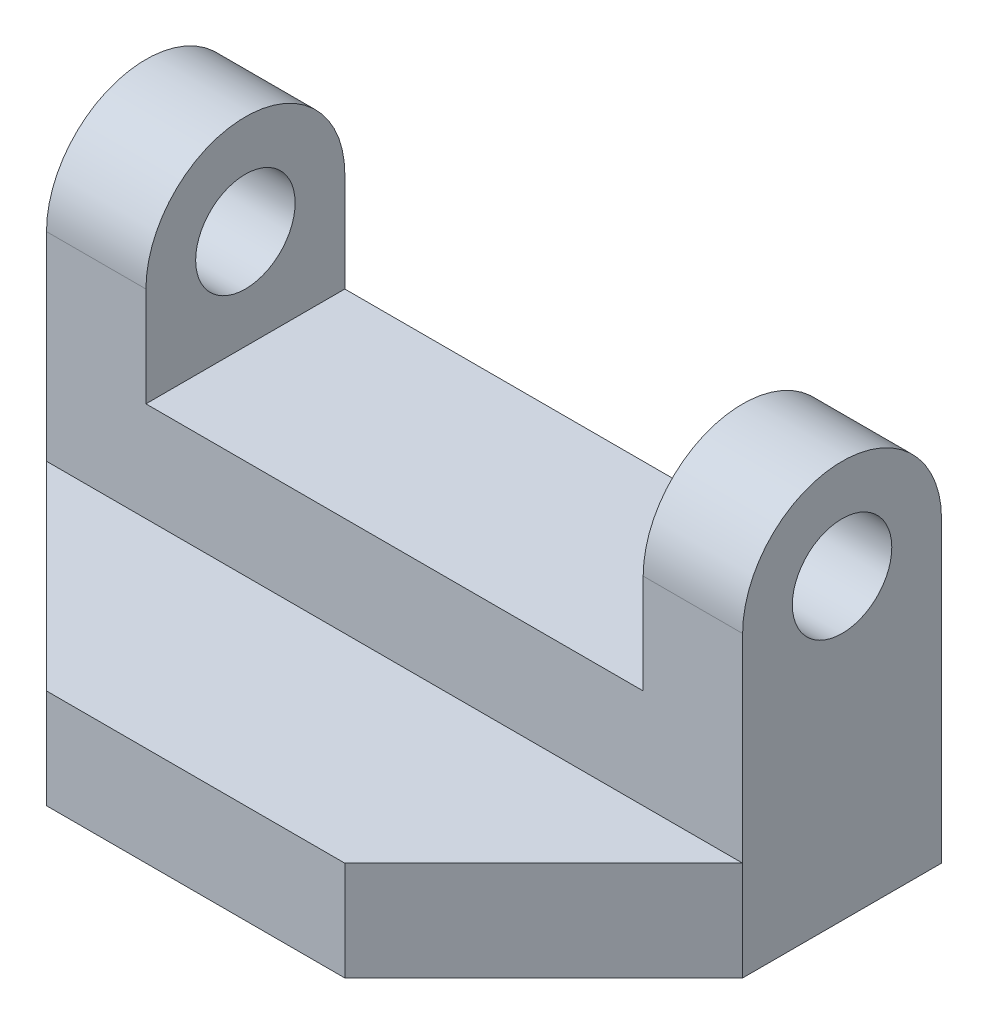
from build123d import *

# Parameters (mm, degrees)
BOSS_EXTRUDE1_DEPTH = 10
SKETCH1_3_W         = 50
SKETCH1_3_H         = 20
BOSS_EXTRUDE2_DEPTH = 20
SKETCH1_4_W         = 10
SKETCH1_4_H         = 20
BOSS_EXTRUDE3_DEPTH = 40
FILLET1_RADIUS      = 10
FILLET1_LENGTH      = 10
FILLET2_RADIUS      = 10
FILLET2_LENGTH      = 10
CUT_EXTRUDE1_REACH  = 76.833
SKETCH2_R           = 5
CUT_EXTRUDE2_START  = 60
SKETCH2_2_R         = 5
CUT_EXTRUDE2_DEPTH  = 70


with BuildPart() as part:
    # Sketch1 → Boss-Extrude1 (new body)
    with BuildSketch(Plane(origin=(0, 0, 0), x_dir=(1, 0, 0), z_dir=(0, 1, 0))):
        Polygon((20, -20), (0, 0), (70, 0), (50, -20), align=None)
    extrude(amount=BOSS_EXTRUDE1_DEPTH)

    # Sketch1<3> → Boss-Extrude2 (add)
    with BuildSketch(Plane(origin=(0, 0, 0), x_dir=(1, 0, 0), z_dir=(0, 1, 0))):
        with Locations((35, 10)):
            Rectangle(SKETCH1_3_W, SKETCH1_3_H)
    extrude(amount=BOSS_EXTRUDE2_DEPTH)

    # Sketch1<4> → Boss-Extrude3 (add)
    with BuildSketch(Plane(origin=(0, 0, 0), x_dir=(1, 0, 0), z_dir=(0, 1, 0))):
        with Locations((65, 10)):
            Rectangle(SKETCH1_4_W, SKETCH1_4_H)
        with Locations((5, 10)):
            Rectangle(SKETCH1_4_W, SKETCH1_4_H)
    extrude(amount=BOSS_EXTRUDE3_DEPTH)

    # Fillet1: full round fillet: the end face becomes a half cylinder, R = half its width
    fillet1_face = Plane((65, 40, -10), x_dir=(-1, 0, 0), z_dir=(0, 1, 0))  # on the end face: x along it, z out of the body
    fillet1_slab = fillet1_face.offset(-FILLET1_RADIUS / 2) * Box(FILLET1_LENGTH, 2 * FILLET1_RADIUS, FILLET1_RADIUS, mode=Mode.PRIVATE)  # the body's end, R deep
    fillet1_round = Plane((65, 30, -10), x_dir=(0, 1, 0), z_dir=(-1, 0, 0)) * Cylinder(FILLET1_RADIUS, FILLET1_LENGTH, mode=Mode.PRIVATE)  # its axis R under the face
    add(fillet1_slab - fillet1_round, mode=Mode.SUBTRACT)

    # Fillet2: full round fillet: the end face becomes a half cylinder, R = half its width
    fillet2_face = Plane((5, 40, -10), x_dir=(-1, 0, 0), z_dir=(0, 1, 0))  # on the end face: x along it, z out of the body
    fillet2_slab = fillet2_face.offset(-FILLET2_RADIUS / 2) * Box(FILLET2_LENGTH, 2 * FILLET2_RADIUS, FILLET2_RADIUS, mode=Mode.PRIVATE)  # the body's end, R deep
    fillet2_round = Plane((5, 30, -10), x_dir=(0, 1, 0), z_dir=(-1, 0, 0)) * Cylinder(FILLET2_RADIUS, FILLET2_LENGTH, mode=Mode.PRIVATE)  # its axis R under the face
    add(fillet2_slab - fillet2_round, mode=Mode.SUBTRACT)

    # Sketch2 → Cut-Extrude1 (cut, up to next)
    with BuildSketch(Plane.ZY.offset(-60), mode=Mode.PRIVATE) as cut_extrude1_sk1:
        with Locations((-10, 30)):
            Circle(SKETCH2_R)
    cut_extrude1_tool1 = extrude(cut_extrude1_sk1.sketch, amount=-CUT_EXTRUDE1_REACH, mode=Mode.PRIVATE) & part.part
    add(cut_extrude1_tool1.solids().sort_by_distance((60, 30, -10))[0], mode=Mode.SUBTRACT)

    # Sketch2<2> → Cut-Extrude2 (cut)
    with BuildSketch(Plane.ZY.offset(-60).offset(CUT_EXTRUDE2_START)):
        with Locations((-10, 30)):
            Circle(SKETCH2_2_R)
    extrude(amount=-CUT_EXTRUDE2_DEPTH, mode=Mode.SUBTRACT)


solid = part.part
